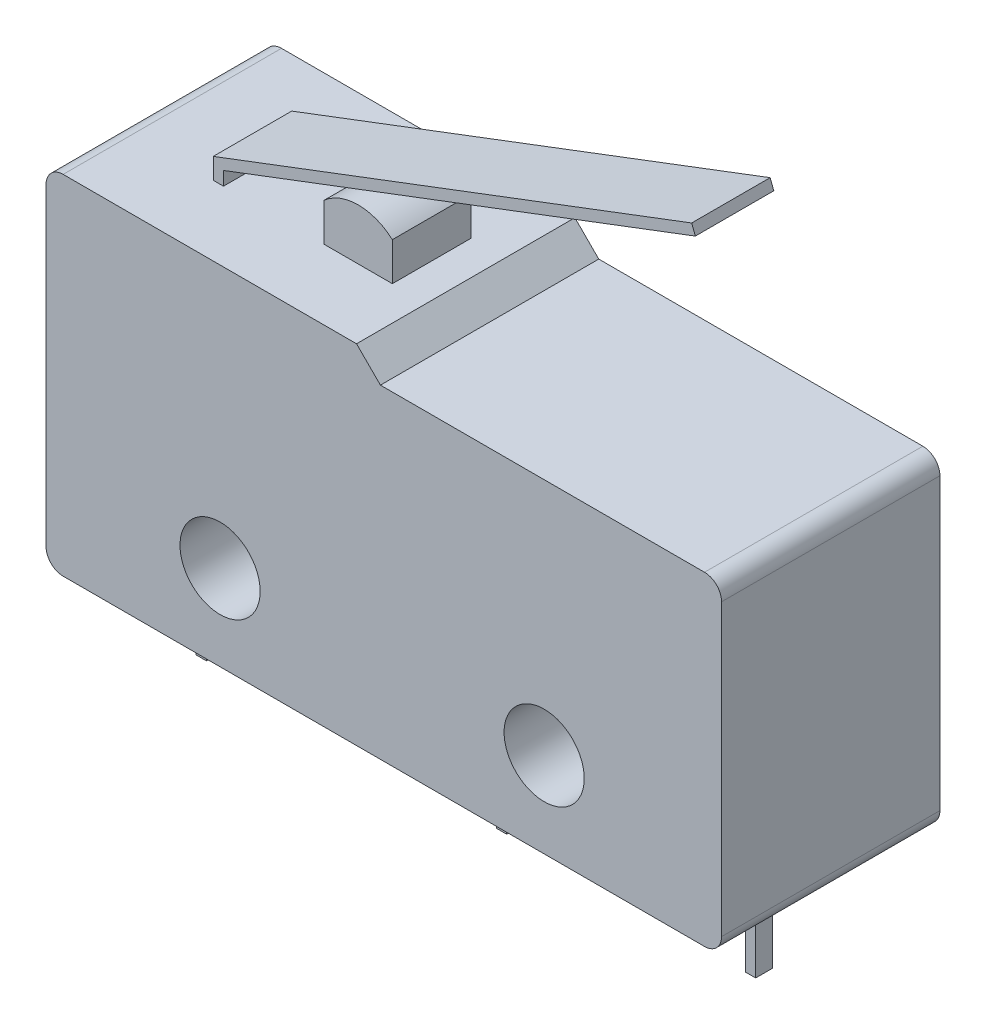
from build123d import *

# Parameters (mm, degrees)
SKETCH_1_R       = 1.175
EXTRUDE_1_DEPTH  = 3.2
EXTRUDE_2_DEPTH  = 1.15
EXTRUDE_10_DEPTH = 1.15
SKETCH_5_W       = 0.3
SKETCH_5_H       = 3
EXTRUDE_12_DEPTH = 0.25


with BuildPart() as part:
    # 草图1 → 凸台-拉伸1 (new, symmetric)
    with BuildSketch(Plane.XY):
        with BuildLine():
            Line((0.5, 0), (9.1, 0))
            Line((9.1, 0), (9.8, -0.7))
            Line((9.8, -0.7), (19.3, -0.7))
            ThreePointArc((19.3, -0.7), (19.653553391, -0.846446609), (19.8, -1.2))
            Line((19.8, -1.2), (19.8, -9.7))
            ThreePointArc((19.8, -9.7), (19.653553391, -10.053553391), (19.3, -10.2))
            Line((19.3, -10.2), (0.5, -10.2))
            ThreePointArc((0.5, -10.2), (0.146446609, -10.053553391), (0, -9.7))
            Line((0, -9.7), (0, -0.5))
            ThreePointArc((0, -0.5), (0.146446609, -0.146446609), (0.5, 0))
        make_face()
        with Locations((5.1, -7.7)):
            Circle(SKETCH_1_R, mode=Mode.SUBTRACT)
        with Locations((14.6, -7.7)):
            Circle(SKETCH_1_R, mode=Mode.SUBTRACT)
    extrude(amount=EXTRUDE_1_DEPTH, both=True)

    # 草图2 → 凸台-拉伸2 (add, symmetric)
    with BuildSketch(Plane.XY):
        with BuildLine():
            Line((6.1, 1.118033989), (6.1, 0))
            Line((6.1, 0), (8.1, 0))
            Line((8.1, 0), (8.1, 1.118033989))
            ThreePointArc((8.1, 1.118033989), (7.1, 1.5), (6.1, 1.118033989))
        make_face()
    extrude(amount=EXTRUDE_2_DEPTH, both=True)

    # 草图4 → 凸台-拉伸10 (add, symmetric)
    with BuildSketch(Plane.XY):
        Polygon((2.85, 0), (3.15, 0), (3.15, 0.4), (16.98060531, 5.648457972), (16.874167088, 5.928941314), (2.85, 0.60703024), align=None)
    extrude(amount=EXTRUDE_10_DEPTH, both=True)

    # 草图5 → 凸台-拉伸12 (add, symmetric)
    with BuildSketch(Plane.XY):
        with Locations((1.6, -11.7)):
            Rectangle(SKETCH_5_W, SKETCH_5_H)
        with Locations((10.4, -11.7)):
            Rectangle(SKETCH_5_W, SKETCH_5_H)
        with Locations((17.7, -11.7)):
            Rectangle(SKETCH_5_W, SKETCH_5_H)
    extrude(amount=EXTRUDE_12_DEPTH, both=True)


solid = part.part
